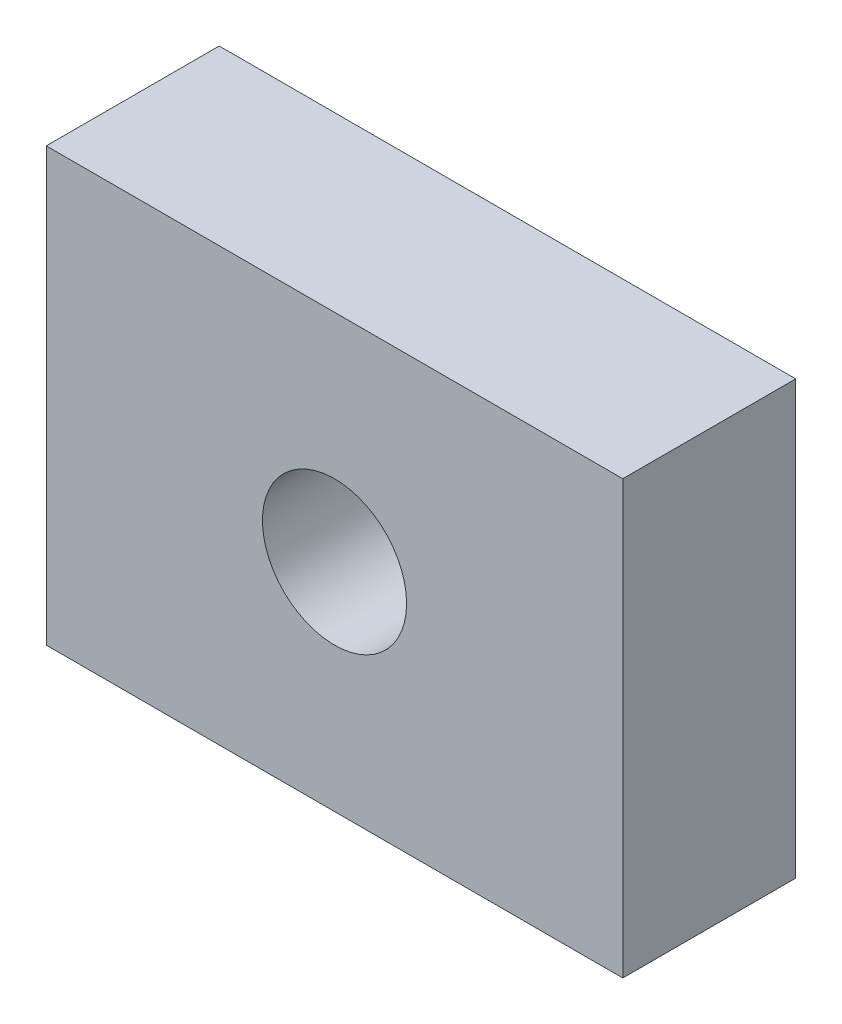
from build123d import *

# Parameters (mm, degrees)
SKETCH_1_W          = 40
SKETCH_1_H          = 30
EXTRUDE_1_DEPTH     = 12
SKETCH_2_R          = 5
CUT_EXTRUDE_1_DEPTH = 28.730849248


with BuildPart() as part:
    # 草图1 → 凸台-拉伸1 (new body)
    with BuildSketch(Plane.XY):
        Rectangle(SKETCH_1_W, SKETCH_1_H)
    extrude(amount=EXTRUDE_1_DEPTH)

    # 草图2 → 切除-拉伸1 (cut, through all)
    with BuildSketch(Plane.XY.offset(12)):
        Circle(SKETCH_2_R)
    extrude(amount=-CUT_EXTRUDE_1_DEPTH, mode=Mode.SUBTRACT)


solid = part.part
